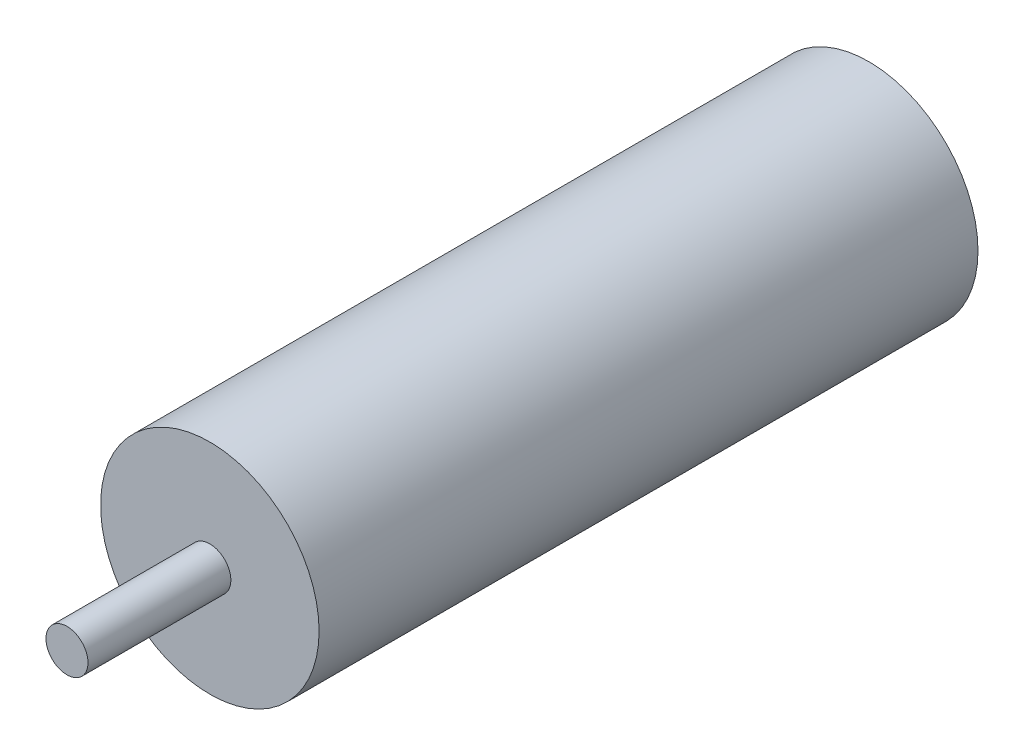
from build123d import *

# Parameters (mm, degrees)
ESQUISSE1_R        = 13
BOSS_EXTRU_1_DEPTH = 78.4
ESQUISSE2_R        = 2.5
BOSS_EXTRU_2_DEPTH = 17


with BuildPart() as part:
    # Esquisse1 → Boss.-Extru.1 (new body)
    with BuildSketch(Plane.XY):
        Circle(ESQUISSE1_R)
    extrude(amount=BOSS_EXTRU_1_DEPTH)

    # Esquisse2 → Boss.-Extru.2 (add)
    with BuildSketch(Plane.XY.offset(78.4)):
        Circle(ESQUISSE2_R)
    extrude(amount=BOSS_EXTRU_2_DEPTH)


solid = part.part
